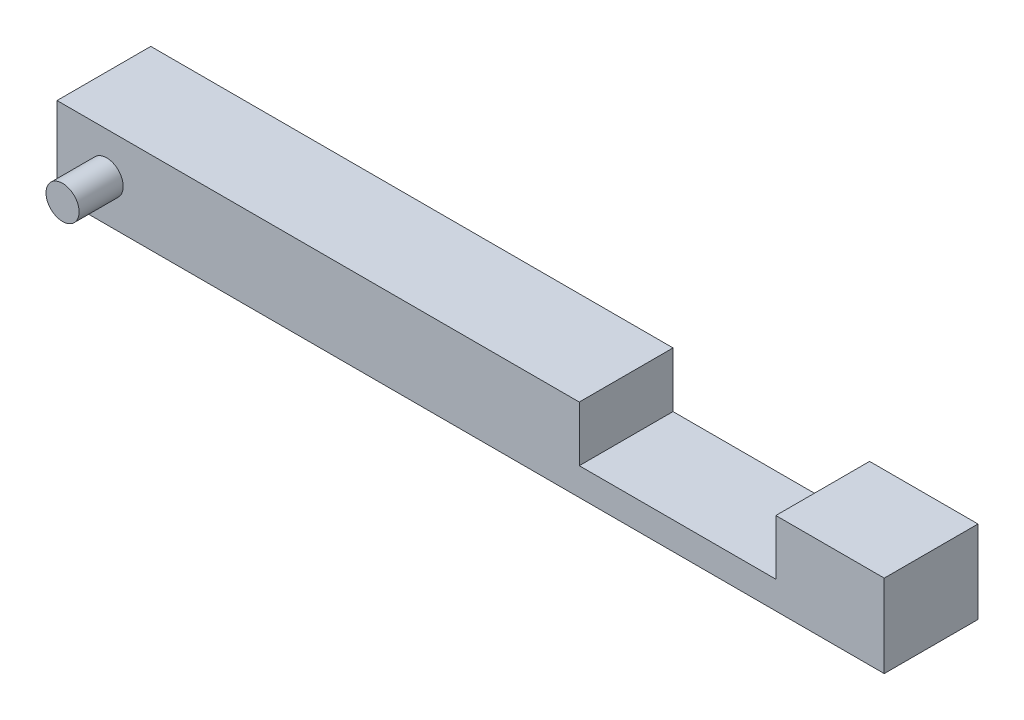
from build123d import *

# Parameters (mm, degrees)
BOSS_EXTRUDE1_DEPTH = 17
SKETCH3_R           = 3.25
CUT_EXTRUDE1_DEPTH  = 6
SKETCH4_R           = 3
BOSS_EXTRUDE2_DEPTH = 8


with BuildPart() as part:
    # Sketch2 → Boss-Extrude1 (new body)
    with BuildSketch(Plane.XY):
        Polygon((-60.590688259, -20.348178138), (89.409311741, -20.348178138), (89.409311741, -5.348178138), (69.749311741, -5.348178138), (69.749311741, -15.348178138), (34.109311741, -15.348178138), (34.109311741, -5.348178138), (-60.590688259, -5.348178138), align=None)
    extrude(amount=BOSS_EXTRUDE1_DEPTH)

    # Sketch3 → Cut-Extrude1 (cut)
    with BuildSketch(Plane(origin=(0, 0, 0), x_dir=(-1, 0, 0), z_dir=(0, 0, -1))):
        with Locations((-14.409311741, -12.848178138)):
            Circle(SKETCH3_R)
        with Locations((51.590688259, -12.848178138)):
            Circle(SKETCH3_R)
    extrude(amount=-CUT_EXTRUDE1_DEPTH, mode=Mode.SUBTRACT)

    # Sketch4 → Boss-Extrude2 (add)
    with BuildSketch(Plane.XY.offset(17)):
        with Locations((-51.590688259, -12.848178138)):
            Circle(SKETCH4_R)
    extrude(amount=BOSS_EXTRUDE2_DEPTH)


solid = part.part
